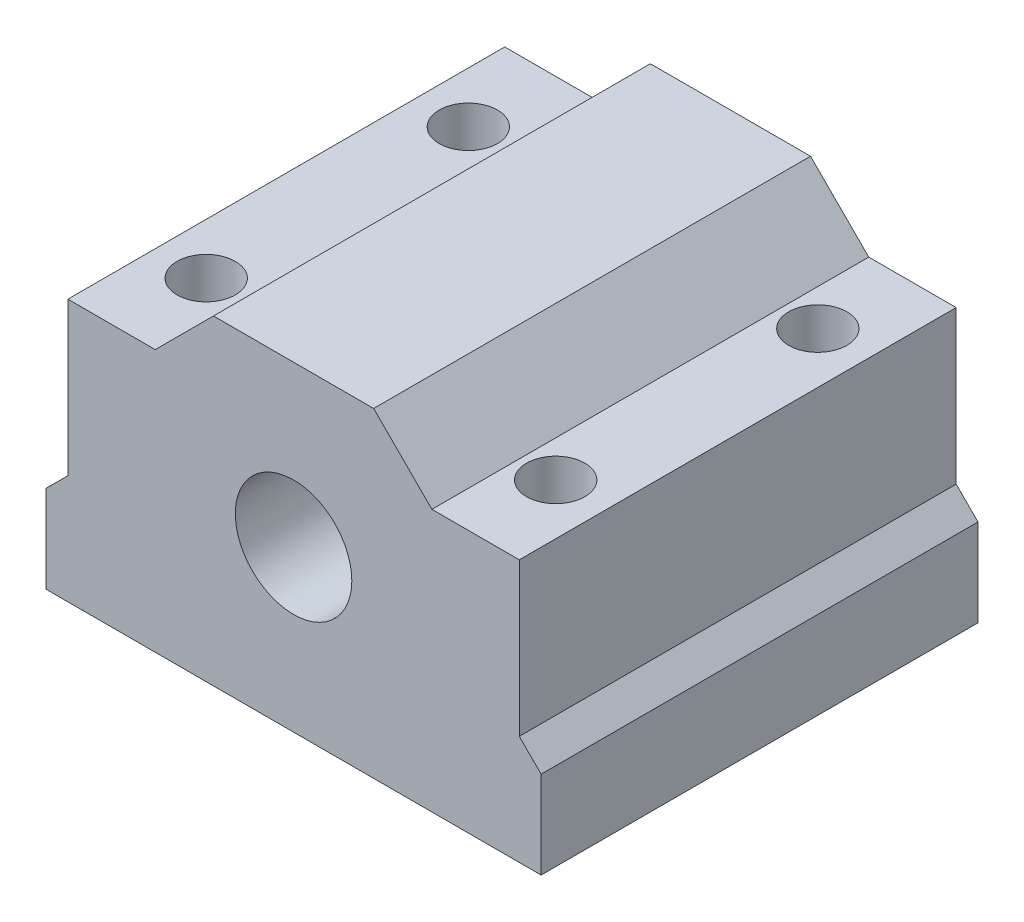
from build123d import *

# Parameters (mm, degrees)
SKETCH_1_R          = 4
EXTRUDE_1_DEPTH     = 30
SKETCH_3_R          = 2
CUT_EXTRUDE_1_DEPTH = 41.902322672


with BuildPart() as part:
    # 草图1 → 凸台-拉伸1 (new body)
    with BuildSketch(Plane.XY):
        Polygon((17, 0), (-17, 0), (-17, 6), (-15.5, 7.5), (-15.5, 18), (-9.5, 18), (-5.5, 22), (5.5, 22), (9.5, 18), (15.5, 18), (15.5, 7.5), (17, 6), align=None)
        with Locations((0, 11)):
            Circle(SKETCH_1_R, mode=Mode.SUBTRACT)
    extrude(amount=EXTRUDE_1_DEPTH)

    # 草图3 → 切除-拉伸1 (cut, through all)
    with BuildSketch(Plane.XZ):
        with Locations(Location((12, 24, 0), (0, 0, 270))):
            Circle(SKETCH_3_R)
        with Locations(Location((-12, 24, 0), (0, 0, 270))):
            Circle(SKETCH_3_R)
        with Locations(Location((-12, 6, 0), (0, 0, 270))):
            Circle(SKETCH_3_R)
        with Locations(Location((12, 6, 0), (0, 0, 270))):
            Circle(SKETCH_3_R)
    extrude(amount=-CUT_EXTRUDE_1_DEPTH, mode=Mode.SUBTRACT)


solid = part.part
